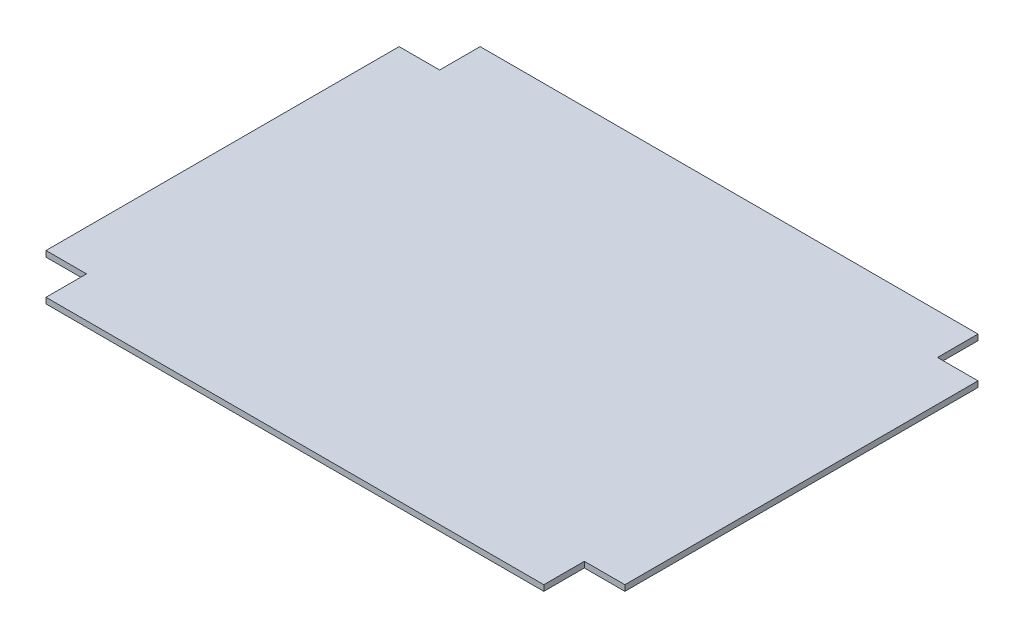
from build123d import *

# Parameters (mm, degrees)
EXTRUDE_1_DEPTH = 6


with BuildPart() as part:
    # Эскиз1 → Бобышка-Вытянуть1 (new body)
    with BuildSketch(Plane(origin=(0, 0, 0), x_dir=(1, 0, 0), z_dir=(0, 1, 0))):
        Polygon((-1446.069787983, -220.62380289), (-1446.069787983, -262.62380289), (-1488.069787983, -262.62380289), (-1488.069787983, -628.62380289), (-1446.069787983, -628.62380289), (-1446.069787983, -670.62380289), (-930.069787983, -670.62380289), (-930.069787983, -628.62380289), (-888.069787983, -628.62380289), (-888.069787983, -262.62380289), (-930.069787983, -262.62380289), (-930.069787983, -220.62380289), align=None)
    extrude(amount=EXTRUDE_1_DEPTH)


solid = part.part
